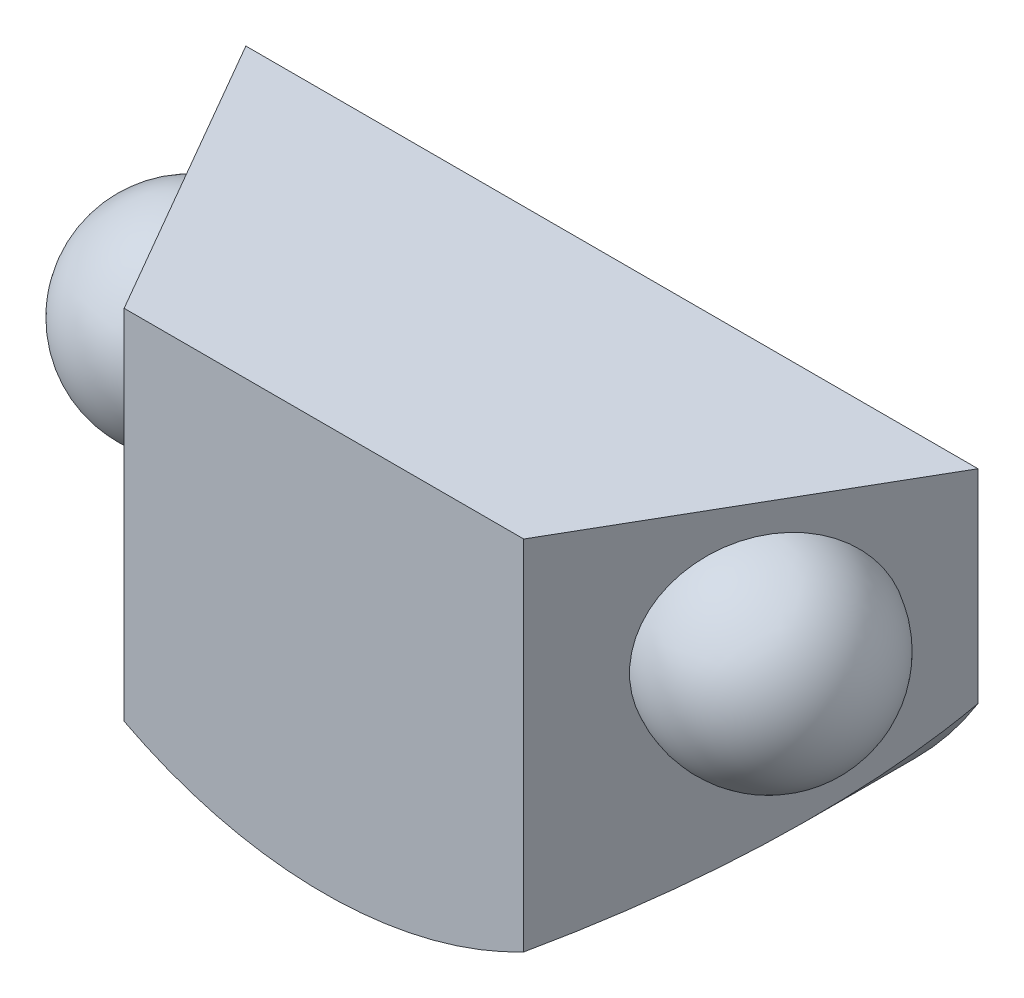
from build123d import *

# Parameters (mm, degrees)
SKETCH1_W                = 180
SKETCH1_H                = 110
BOSS_EXTRUDE1_DEPTH      = 50
BOSS_EXTRUDE2_DEPTH      = 110
CUT_EXTRUDE1_DEPTH       = 146.344418537
BOSS_EXTRUDE5_DEPTH      = 10
BOSS_EXTRUDE5_DEPTH_BACK = 10
SKETCH5_R                = 5
SKETCH6_W                = 180.23839675
SKETCH6_H                = 55.735834074
CUT_EXTRUDE2_DEPTH       = 125


with BuildPart() as part:
    # Sketch1 → Boss-Extrude1 (new body)
    with BuildSketch(Plane(origin=(0, 0, 0), x_dir=(1, 0, 0), z_dir=(0, 1, 0))):
        Rectangle(SKETCH1_W, SKETCH1_H)
    extrude(amount=BOSS_EXTRUDE1_DEPTH)

    # Sketch2 → Boss-Extrude2 (add)
    with BuildSketch(Plane(origin=(-35, 0, -55), x_dir=(1, 0, 0), z_dir=(0, 0, 1))):
        with BuildLine():
            Line((-55, 0), (125, 0))
            ThreePointArc((125, 0), (35, -50), (-55, 0))
        make_face()
    extrude(amount=BOSS_EXTRUDE2_DEPTH)

    # Sketch3 → Cut-Extrude1 (cut, through all)
    with BuildSketch(Plane(origin=(0, 50, 0), x_dir=(1, 0, 0), z_dir=(0, 1, 0))):
        Polygon((-49.118803686, -55), (-90, 15.808309091), (-90, -55), align=None)
    cut_extrude1 = extrude(amount=-CUT_EXTRUDE1_DEPTH, mode=Mode.SUBTRACT)

    # Mirror1: Cut-Extrude1 across plane
    add(cut_extrude1.mirror(Plane(origin=(0, 0, 0), x_dir=(0, 0, 1), z_dir=(1, 0, 0))), mode=Mode.SUBTRACT)

    # Sketch5 → Boss-Extrude5 (add, two sides: drawn at the far end of the back side and taken through both)
    with BuildSketch(Plane(origin=(0, 0, -55), x_dir=(-1, 0, 0), z_dir=(0, 0, -1)).offset(-BOSS_EXTRUDE5_DEPTH_BACK)):
        Circle(SKETCH5_R)
    extrude(amount=BOSS_EXTRUDE5_DEPTH + BOSS_EXTRUDE5_DEPTH_BACK)

    # Sketch4 → Revolve1 (revolve)
    with BuildSketch(Plane(origin=(-60.654801368, 0, 35.019065898), x_dir=(0.49999999999999495, 0, 0.8660254037844417), z_dir=(-0.8660254037844417, 0, 0.49999999999999495))):
        with BuildLine():
            ThreePointArc((-20.965161058, 42.942576489), (4.034838942, 17.942576489), (-20.965161058, -7.057423511))
            Line((-20.965161058, -7.057423511), (-20.965161058, 42.942576489))
        make_face()
    revolve1 = revolve(axis=Axis((-71.137381897, 42.942576489, 16.862703827), (0, -1, 0)))

    # Mirror2: Revolve1 across plane
    add(revolve1.mirror(Plane(origin=(0, 0, 0), x_dir=(0, 0, 1), z_dir=(1, 0, 0))))

    # Sketch6 → Cut-Extrude2 (cut)
    with BuildSketch(Plane(origin=(0, 50, 0), x_dir=(1, 0, 0), z_dir=(0, 1, 0))):
        with Locations((0.119198375, 43.676226128)):
            Rectangle(SKETCH6_W, SKETCH6_H)
    extrude(amount=-CUT_EXTRUDE2_DEPTH, mode=Mode.SUBTRACT)


solid = part.part
